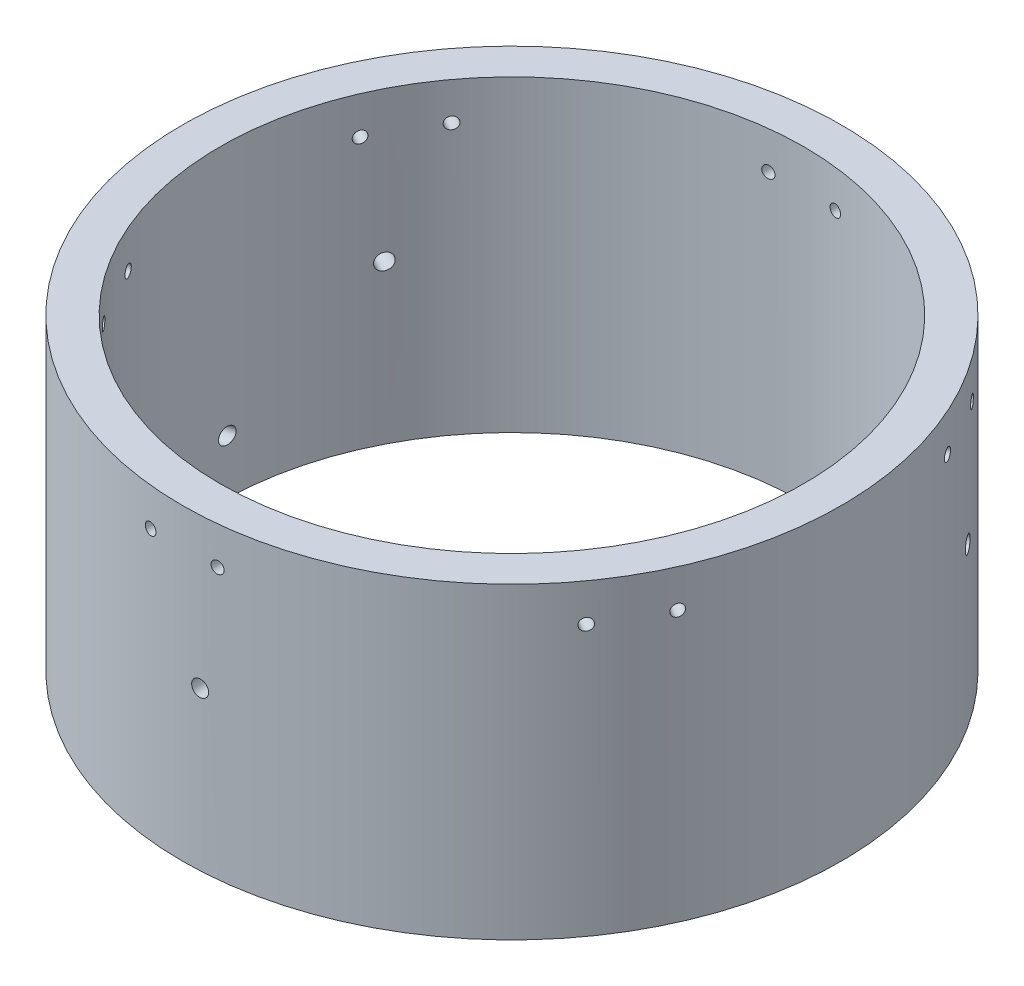
from build123d import *

# Parameters (mm, degrees)
SKETCH1_R                     = 55.5625
SKETCH1_R_2                   = 1.0033
SKETCH1_R_3                   = 49.2125
BOSS_EXTRUDE1_DEPTH           = 51.9303
CUT_EXTRUDE1_REACH            = 96.187
CUT_EXTRUDE1_END_RADIUS       = 55.5625
SKETCH2_R                     = 1.0033
CUT_EXTRUDE5_REACH            = 96.187
CUT_EXTRUDE5_END_RADIUS       = 55.5625
SKETCH5_R                     = 1.3589
CIRPATTERN1_COUNT             = 6
CIRPATTERN1_COPY_1_REACH      = 96.187
CIRPATTERN1_COPY_1_END_RADIUS = 55.5625
CIRPATTERN1_COPY_1_SKETCH_R   = 1.0033
CIRPATTERN1_COPY_2_REACH      = 96.187
CIRPATTERN1_COPY_2_END_RADIUS = 55.5625
CIRPATTERN1_COPY_2_SKETCH_R   = 1.0033
CIRPATTERN1_COPY_3_REACH      = 96.187
CIRPATTERN1_COPY_3_END_RADIUS = 55.5625
CIRPATTERN1_COPY_3_SKETCH_R   = 1.0033
CIRPATTERN1_COPY_4_REACH      = 96.187
CIRPATTERN1_COPY_4_END_RADIUS = 55.5625
CIRPATTERN1_COPY_4_SKETCH_R   = 1.0033
CIRPATTERN1_COPY_5_REACH      = 96.187
CIRPATTERN1_COPY_5_END_RADIUS = 55.5625
CIRPATTERN1_COPY_5_SKETCH_R   = 1.0033
SKETCH1_6_R                   = 1.0033
CUT_EXTRUDE3_DEPTH            = 5.08
CIRPATTERN2_COUNT             = 12
CIRPATTERN3_COUNT             = 3
CUT_EXTRUDE4_REACH            = 96.187
CUT_EXTRUDE4_END_RADIUS       = 55.5625
SKETCH3_R                     = 3.6576
SKETCH3_R_2                   = 1.3589
SKETCH7_R                     = 1.5
CUT_EXTRUDE6_DEPTH            = 6.35
CIRPATTERN4_COUNT             = 3


with BuildPart() as part:
    # Sketch1 → Boss-Extrude1 (new body)
    # profile 1 of 2: a face of its own
    with BuildSketch(Plane(origin=(0, 0, 0), x_dir=(1, 0, 0), z_dir=(0, 1, 0))):
        with Locations(Location((0, 0, 0), (0, 0, 270))):
            Circle(SKETCH1_R)
        with Locations((36.391415382, -37.68441379)):
            Circle(SKETCH1_R_2, mode=Mode.SUBTRACT)
        with Locations(Location((0, 0, 0), (0, 0, 270))):
            Circle(SKETCH1_R_3, mode=Mode.SUBTRACT)
    # profile 2 of 2: a face of its own
    with BuildSketch(Plane(origin=(0, 0, 0), x_dir=(1, 0, 0), z_dir=(0, 1, 0))):
        with Locations((36.391415382, -37.68441379)):
            Circle(SKETCH1_R_2)
    extrude(amount=BOSS_EXTRUDE1_DEPTH)

    # Cut-Extrude1: up to this cylinder (the profile starts inside it)
    cut_extrude1_end = Plane(origin=(0, 45.5803, 0), z_dir=(0, -1, 0)) * Cylinder(CUT_EXTRUDE1_END_RADIUS, 304.499, mode=Mode.PRIVATE)
    # Sketch2 → Cut-Extrude1 (cut, up to the surface)
    with BuildSketch(Plane.XY, mode=Mode.PRIVATE) as cut_extrude1_sk1:
        with Locations(Location((-5.644444444, 45.5803, 0), (0, 0, 180))):
            Circle(SKETCH2_R)
    cut_extrude1_tool1 = extrude(cut_extrude1_sk1.sketch, amount=CUT_EXTRUDE1_REACH, mode=Mode.PRIVATE) & cut_extrude1_end
    cut_extrude1 = cut_extrude1_tool1.solids().sort_by_distance((-5.644444, 45.5803, 0))[0]
    add(cut_extrude1, mode=Mode.SUBTRACT)

    # Cut-Extrude5: up to this cylinder (the profile starts inside it)
    cut_extrude5_end = Plane(origin=(0, 26.67, 0), z_dir=(0, -1, 0)) * Cylinder(CUT_EXTRUDE5_END_RADIUS, 304.499, mode=Mode.PRIVATE)
    # Sketch5 → Cut-Extrude5 (cut, up to the surface)
    with BuildSketch(Plane(origin=(0, 0, 0), x_dir=(0.9986295347545739, 0, -0.05233595624294449), z_dir=(0.05233595624294449, 0, 0.9986295347545739)), mode=Mode.PRIVATE) as cut_extrude5_sk1:
        with Locations(Location((0, 26.67, 0), (0, 0, 180))):
            Circle(SKETCH5_R)
    cut_extrude5_tool1 = extrude(cut_extrude5_sk1.sketch, amount=CUT_EXTRUDE5_REACH, mode=Mode.PRIVATE) & cut_extrude5_end
    cut_extrude5 = cut_extrude5_tool1.solids().sort_by_distance((0, 26.67, 0))[0]
    add(cut_extrude5, mode=Mode.SUBTRACT)

    # Mirror1: Cut-Extrude1 across plane
    add(cut_extrude1.mirror(Plane(origin=(0, 0, 0), x_dir=(0, 0, 1), z_dir=(1, 0, 0))), mode=Mode.SUBTRACT)

    # CirPattern1: Cut-Extrude1 ×6 about axis
    cirpattern1_axis = Axis((0, 51.9303, 0), (0, 1, 0))
    for i in range(1, CIRPATTERN1_COUNT):
        add(cut_extrude1.rotate(cirpattern1_axis, i * 360 / CIRPATTERN1_COUNT), mode=Mode.SUBTRACT)

    # CirPattern1 copy 1: up to this cylinder (the profile starts inside it)
    cirpattern1_copy_1_end = Plane(origin=(0, 45.5803, 0), z_dir=(0, -1, 0)) * Cylinder(CIRPATTERN1_COPY_1_END_RADIUS, 304.499, mode=Mode.PRIVATE)
    # CirPattern1 copy 1 sketch → CirPattern1 copy 1 (cut, up to the surface)
    with BuildSketch(Plane(origin=(0, 0, 0), x_dir=(-0.5000000000000001, 0, 0.8660254037844386), z_dir=(0.8660254037844386, 0, 0.5000000000000001)), mode=Mode.PRIVATE) as cirpattern1_copy_1_sk1:
        with Locations((-5.644444444, -45.5803)):
            Circle(CIRPATTERN1_COPY_1_SKETCH_R)
    cirpattern1_copy_1_tool1 = extrude(cirpattern1_copy_1_sk1.sketch, amount=CIRPATTERN1_COPY_1_REACH, mode=Mode.PRIVATE) & cirpattern1_copy_1_end
    add(cirpattern1_copy_1_tool1.solids().sort_by_distance((-5.644444, 45.5803, 0))[0], mode=Mode.SUBTRACT)

    # CirPattern1 copy 2: up to this cylinder (the profile starts inside it)
    cirpattern1_copy_2_end = Plane(origin=(0, 45.5803, 0), z_dir=(0, -1, 0)) * Cylinder(CIRPATTERN1_COPY_2_END_RADIUS, 304.499, mode=Mode.PRIVATE)
    # CirPattern1 copy 2 sketch → CirPattern1 copy 2 (cut, up to the surface)
    with BuildSketch(Plane(origin=(0, 0, 0), x_dir=(0.4999999999999998, 0, 0.8660254037844387), z_dir=(0.8660254037844387, 0, -0.4999999999999998)), mode=Mode.PRIVATE) as cirpattern1_copy_2_sk1:
        with Locations((-5.644444444, -45.5803)):
            Circle(CIRPATTERN1_COPY_2_SKETCH_R)
    cirpattern1_copy_2_tool1 = extrude(cirpattern1_copy_2_sk1.sketch, amount=CIRPATTERN1_COPY_2_REACH, mode=Mode.PRIVATE) & cirpattern1_copy_2_end
    add(cirpattern1_copy_2_tool1.solids().sort_by_distance((-5.644444, 45.5803, 0))[0], mode=Mode.SUBTRACT)

    # CirPattern1 copy 3: up to this cylinder (the profile starts inside it)
    cirpattern1_copy_3_end = Plane(origin=(0, 45.5803, 0), z_dir=(0, -1, 0)) * Cylinder(CIRPATTERN1_COPY_3_END_RADIUS, 304.499, mode=Mode.PRIVATE)
    # CirPattern1 copy 3 sketch → CirPattern1 copy 3 (cut, up to the surface)
    with BuildSketch(Plane(origin=(0, 0, 0), x_dir=(1, 0, 0), z_dir=(0, 0, -1)), mode=Mode.PRIVATE) as cirpattern1_copy_3_sk1:
        with Locations((-5.644444444, -45.5803)):
            Circle(CIRPATTERN1_COPY_3_SKETCH_R)
    cirpattern1_copy_3_tool1 = extrude(cirpattern1_copy_3_sk1.sketch, amount=CIRPATTERN1_COPY_3_REACH, mode=Mode.PRIVATE) & cirpattern1_copy_3_end
    add(cirpattern1_copy_3_tool1.solids().sort_by_distance((-5.644444, 45.5803, 0))[0], mode=Mode.SUBTRACT)

    # CirPattern1 copy 4: up to this cylinder (the profile starts inside it)
    cirpattern1_copy_4_end = Plane(origin=(0, 45.5803, 0), z_dir=(0, -1, 0)) * Cylinder(CIRPATTERN1_COPY_4_END_RADIUS, 304.499, mode=Mode.PRIVATE)
    # CirPattern1 copy 4 sketch → CirPattern1 copy 4 (cut, up to the surface)
    with BuildSketch(Plane(origin=(0, 0, 0), x_dir=(0.5000000000000004, 0, -0.8660254037844384), z_dir=(-0.8660254037844384, 0, -0.5000000000000004)), mode=Mode.PRIVATE) as cirpattern1_copy_4_sk1:
        with Locations((-5.644444444, -45.5803)):
            Circle(CIRPATTERN1_COPY_4_SKETCH_R)
    cirpattern1_copy_4_tool1 = extrude(cirpattern1_copy_4_sk1.sketch, amount=CIRPATTERN1_COPY_4_REACH, mode=Mode.PRIVATE) & cirpattern1_copy_4_end
    add(cirpattern1_copy_4_tool1.solids().sort_by_distance((-5.644444, 45.5803, 0))[0], mode=Mode.SUBTRACT)

    # CirPattern1 copy 5: up to this cylinder (the profile starts inside it)
    cirpattern1_copy_5_end = Plane(origin=(0, 45.5803, 0), z_dir=(0, -1, 0)) * Cylinder(CIRPATTERN1_COPY_5_END_RADIUS, 304.499, mode=Mode.PRIVATE)
    # CirPattern1 copy 5 sketch → CirPattern1 copy 5 (cut, up to the surface)
    with BuildSketch(Plane(origin=(0, 0, 0), x_dir=(-0.5000000000000001, 0, -0.8660254037844386), z_dir=(-0.8660254037844386, 0, 0.5000000000000001)), mode=Mode.PRIVATE) as cirpattern1_copy_5_sk1:
        with Locations((-5.644444444, -45.5803)):
            Circle(CIRPATTERN1_COPY_5_SKETCH_R)
    cirpattern1_copy_5_tool1 = extrude(cirpattern1_copy_5_sk1.sketch, amount=CIRPATTERN1_COPY_5_REACH, mode=Mode.PRIVATE) & cirpattern1_copy_5_end
    add(cirpattern1_copy_5_tool1.solids().sort_by_distance((-5.644444, 45.5803, 0))[0], mode=Mode.SUBTRACT)

    # Sketch1<6> → Cut-Extrude3 (cut)
    with BuildSketch(Plane(origin=(0, 0, 0), x_dir=(1, 0, 0), z_dir=(0, 1, 0))):
        with Locations(Location((36.391415382, -37.68441379, 0), (0, 0, 270))):
            Circle(SKETCH1_6_R)
    cut_extrude3 = extrude(amount=CUT_EXTRUDE3_DEPTH, mode=Mode.SUBTRACT)

    # CirPattern2: Cut-Extrude3 ×12 about axis
    cirpattern2_axis = Axis((0, 0, 0), (0, 1, 0))
    for i in range(1, CIRPATTERN2_COUNT):
        add(cut_extrude3.rotate(cirpattern2_axis, i * 360 / CIRPATTERN2_COUNT), mode=Mode.SUBTRACT)

    # CirPattern3: Cut-Extrude5 ×3 about axis
    cirpattern3_axis = Axis((0, 51.9303, 0), (0, 1, 0))
    for i in range(1, CIRPATTERN3_COUNT):
        add(cut_extrude5.rotate(cirpattern3_axis, i * 360 / CIRPATTERN3_COUNT), mode=Mode.SUBTRACT)

    # Cut-Extrude4: up to this cylinder (the profile starts inside it)
    cut_extrude4_end = Plane(origin=(0, 9.144, 0), z_dir=(0, -1, 0)) * Cylinder(CUT_EXTRUDE4_END_RADIUS, 304.499, mode=Mode.PRIVATE)
    # Sketch3 → Cut-Extrude4 (cut, up to the surface)
    with BuildSketch(Plane(origin=(0, 0, 0), x_dir=(0.3255681544571542, 0, 0.9455185755993178), z_dir=(-0.9455185755993178, 0, 0.3255681544571542)), mode=Mode.PRIVATE) as cut_extrude4_sk1:
        with Locations(Location((0, 9.144, 0), (0, 0, 180))):
            Circle(SKETCH3_R)
    cut_extrude4_tool1 = extrude(cut_extrude4_sk1.sketch, amount=CUT_EXTRUDE4_REACH, mode=Mode.PRIVATE) & cut_extrude4_end
    add(cut_extrude4_tool1.solids().sort_by_distance((0, 9.144, 0))[0], mode=Mode.SUBTRACT)
    # Sketch3 → Cut-Extrude4 (cut, up to the surface)
    with BuildSketch(Plane(origin=(0, 0, 0), x_dir=(0.3255681544571542, 0, 0.9455185755993178), z_dir=(-0.9455185755993178, 0, 0.3255681544571542)), mode=Mode.PRIVATE) as cut_extrude4_sk2:
        with Locations(Location((-17.145, 9.144, 0), (0, 0, 180))):
            Circle(SKETCH3_R_2)
    cut_extrude4_tool2 = extrude(cut_extrude4_sk2.sketch, amount=CUT_EXTRUDE4_REACH, mode=Mode.PRIVATE) & cut_extrude4_end
    add(cut_extrude4_tool2.solids().sort_by_distance((-5.581866, 9.144, -16.210916))[0], mode=Mode.SUBTRACT)
    # Sketch3 → Cut-Extrude4 (cut, up to the surface)
    with BuildSketch(Plane(origin=(0, 0, 0), x_dir=(0.3255681544571542, 0, 0.9455185755993178), z_dir=(-0.9455185755993178, 0, 0.3255681544571542)), mode=Mode.PRIVATE) as cut_extrude4_sk3:
        with Locations(Location((17.145, 9.144, 0), (0, 0, 180))):
            Circle(SKETCH3_R_2)
    cut_extrude4_tool3 = extrude(cut_extrude4_sk3.sketch, amount=CUT_EXTRUDE4_REACH, mode=Mode.PRIVATE) & cut_extrude4_end
    add(cut_extrude4_tool3.solids().sort_by_distance((5.581866, 9.144, 16.210916))[0], mode=Mode.SUBTRACT)

    # Sketch7 → Cut-Extrude6 (cut)
    with BuildSketch(Plane.XZ):
        with Locations(Location((-0.914287942, 52.37952113, 0), (0, 0, 270))):
            Circle(SKETCH7_R)
    cut_extrude6 = extrude(amount=-CUT_EXTRUDE6_DEPTH, mode=Mode.SUBTRACT)

    # CirPattern4: Cut-Extrude6 ×3 about axis
    cirpattern4_axis = Axis((0, 0, 0), (0, 1, 0))
    for i in range(1, CIRPATTERN4_COUNT):
        add(cut_extrude6.rotate(cirpattern4_axis, i * 360 / CIRPATTERN4_COUNT), mode=Mode.SUBTRACT)


solid = part.part
